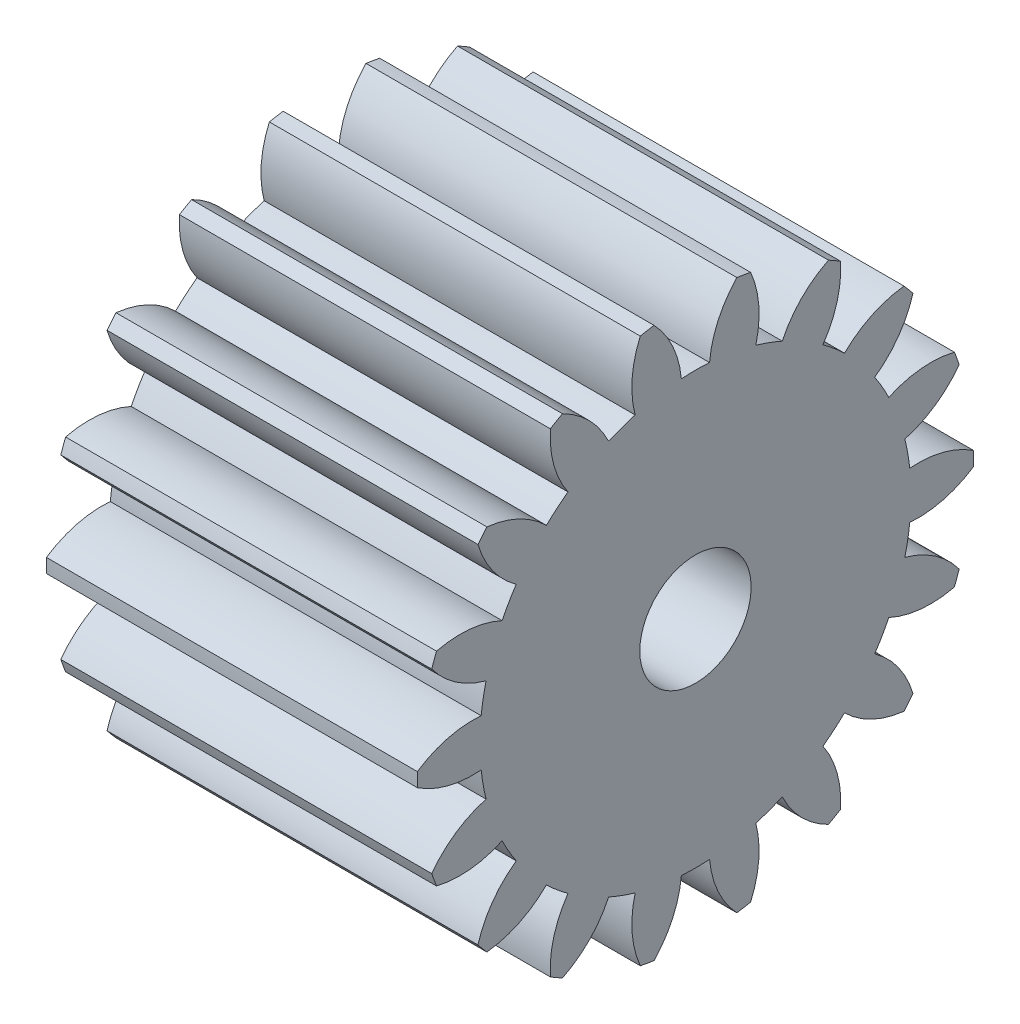
from build123d import *

# Parameters (mm, degrees)
BASPROSKE_W     = 20
BASPROSKE_H     = 15
TOOTHCUT_DEPTH  = 30.154759474
TEETHCUTS_COUNT = 18
TEETHCUTS_ANGLE = 340
BORSKE_R        = 3
BORE_DEPTH      = 50.0000508


with BuildPart() as part:
    # BasProSke → Base-Revolve (revolve)
    with BuildSketch(Plane(origin=(0, 0, 0), x_dir=(1, 0, 0), z_dir=(0, 1, 0)), mode=Mode.PRIVATE) as base_revolve_sk:
        with Locations((10, 7.5)):
            Rectangle(BASPROSKE_W, BASPROSKE_H)
    revolve(base_revolve_sk.sketch.rotate(Axis((-10, 0, 0), (1, 0, 0)), 180), axis=Axis((-10, 0, 0), (1, 0, 0)))

    # TooCutSke → ToothCut (cut, through all)
    with BuildSketch(Plane(origin=(0, 0, 0), x_dir=(0, 0, -1), z_dir=(1, 0, 0))):
        with BuildLine():
            ThreePointArc((0.759974923, 11.599129886), (0, 11.624), (-0.759974923, 11.599129886))
            ThreePointArc((-0.759974923, 11.599129886), (-1.229186471, 13.354767823), (-2.254227748, 14.855339189))
            ThreePointArc((-2.254227748, 14.855339189), (0, 15.0254), (2.254227748, 14.855339189))
            ThreePointArc((2.254227748, 14.855339189), (1.229186471, 13.354767823), (0.759974923, 11.599129886))
        make_face()
    toothcut = extrude(amount=TOOTHCUT_DEPTH, mode=Mode.SUBTRACT)

    # TeethCuts: ToothCut ×18 about axis
    teethcuts_axis = Axis((-10, 0, 0), (1, 0, 0))
    for i in range(1, TEETHCUTS_COUNT):
        add(toothcut.rotate(teethcuts_axis, i * TEETHCUTS_ANGLE / (TEETHCUTS_COUNT - 1)), mode=Mode.SUBTRACT)

    # BorSke → Bore (cut, symmetric)
    with BuildSketch(Plane(origin=(0, 0, 0), x_dir=(0, 0, -1), z_dir=(1, 0, 0))):
        with Locations(Location((0, 0, 0), (0, 0, 180))):
            Circle(BORSKE_R)
    extrude(amount=BORE_DEPTH, both=True, mode=Mode.SUBTRACT)


solid = part.part
